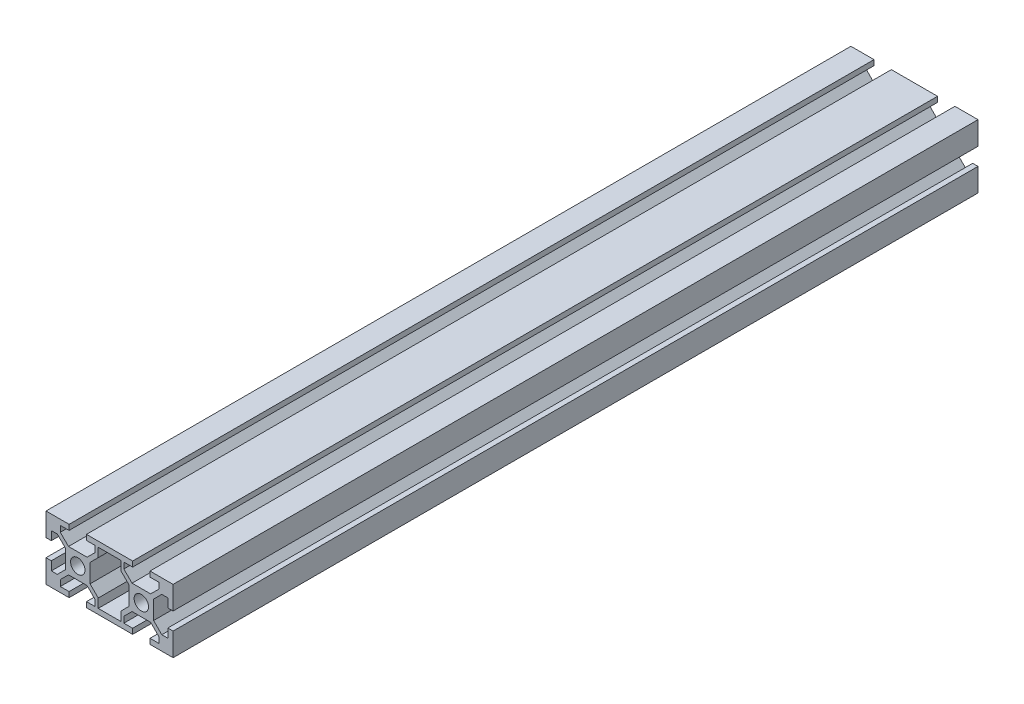
from build123d import *

# Parameters (mm, degrees)
SKETCH_1_R      = 3.4
EXTRUDE_1_DEPTH = 380


with BuildPart() as part:
    # 草图1 → 凸台-拉伸1 (new body)
    with BuildSketch(Plane.XY):
        Polygon((-4.1, 12.5), (-4.1, 15), (-8.25, 15), (-15, 15), (-15, 8.25), (-15, 4.1), (-12.5, 4.1), (-12.5, 8.25), (-9.664213562, 8.25), (-5.8, 4.385786438), (-5.8, -4.385786438), (-9.664213562, -8.25), (-12.5, -8.25), (-12.5, -4.1), (-15, -4.1), (-15, -8.25), (-15, -15), (-8.25, -15), (-4.1, -15), (-4.1, -12.5), (-8.25, -12.5), (-8.25, -9.664213562), (-4.385786438, -5.8), (4.385786438, -5.8), (8.25, -9.664213562), (8.25, -12.5), (4.1, -12.5), (4.1, -15), (8.25, -15), (15, -15), (21.75, -15), (25.9, -15), (25.9, -12.5), (21.75, -12.5), (21.75, -9.664213562), (25.614213562, -5.8), (34.385786438, -5.8), (38.25, -9.664213562), (38.25, -12.5), (34.1, -12.5), (34.1, -15), (38.25, -15), (45, -15), (45, -8.25), (45, -4.1), (42.5, -4.1), (42.5, -8.25), (39.664213562, -8.25), (35.8, -4.385786438), (35.8, 4.385786438), (39.664213562, 8.25), (42.5, 8.25), (42.5, 4.1), (45, 4.1), (45, 8.25), (45, 15), (38.25, 15), (34.1, 15), (34.1, 12.5), (38.25, 12.5), (38.25, 9.664213562), (34.385786438, 5.8), (25.614213562, 5.8), (21.75, 9.664213562), (21.75, 12.5), (25.9, 12.5), (25.9, 15), (21.75, 15), (15, 15), (8.25, 15), (4.1, 15), (4.1, 12.5), (8.25, 12.5), (8.25, 9.664213562), (4.385786438, 5.8), (-4.385786438, 5.8), (-8.25, 9.664213562), (-8.25, 12.5), align=None)
        Circle(SKETCH_1_R, mode=Mode.SUBTRACT)
        Polygon((9.664213562, -8.25), (5.8, -4.385786438), (5.8, 4.385786438), (9.664213562, 8.25), (9.664213562, 12.5), (20.335786438, 12.5), (20.335786438, 8.25), (24.2, 4.385786438), (24.2, -4.385786438), (20.335786438, -8.25), (20.335786438, -12.5), (9.664213562, -12.5), align=None, mode=Mode.SUBTRACT)
        with Locations((30, 0)):
            Circle(SKETCH_1_R, mode=Mode.SUBTRACT)
    extrude(amount=EXTRUDE_1_DEPTH)


solid = part.part
